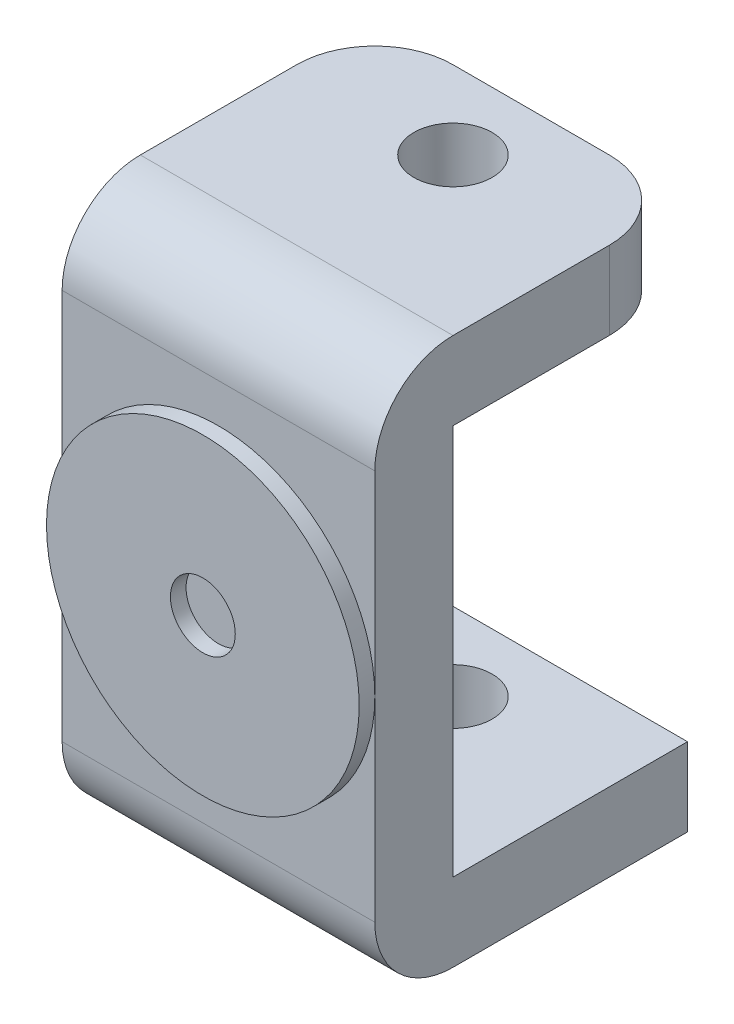
from build123d import *

# Parameters (mm, degrees)
SKETCH1_W           = 4
SKETCH1_H           = 5
BOSS_EXTRUDE1_DEPTH = 1
SKETCH2_W           = 4
SKETCH2_H           = 1
BOSS_EXTRUDE2_DEPTH = 2
FILLET1_R           = 1
SKETCH3_R           = 2
SKETCH3_R_2         = 0.415
BOSS_EXTRUDE3_DEPTH = 0.2
SKETCH4_R           = 0.5
CUT_EXTRUDE1_DEPTH  = 8.874007874


with BuildPart() as part:
    # Sketch1 → Boss-Extrude1 (new body)
    with BuildSketch(Plane.XY):
        Rectangle(SKETCH1_W, SKETCH1_H)
    extrude(amount=BOSS_EXTRUDE1_DEPTH)

    # Sketch2 → Boss-Extrude2 (add, symmetric)
    with BuildSketch(Plane(origin=(0, 0, 0), x_dir=(0, 0, -1), z_dir=(1, 0, 0))):
        with Locations((1, 3)):
            Rectangle(SKETCH2_W, SKETCH2_H)
        with Locations((1, -3)):
            Rectangle(SKETCH2_W, SKETCH2_H)
    extrude(amount=BOSS_EXTRUDE2_DEPTH, both=True)

    # Fillet1
    fillet1_edges = [part.edges().sort_by_distance(p)[0] for p in [
        (0, 3.5, 1),
        (-2, 3, -3),
        (2, 3, -3),
        (0, -3.5, 1),
    ]]
    fillet(fillet1_edges, radius=FILLET1_R)

    # Sketch3 → Boss-Extrude3 (add)
    with BuildSketch(Plane.XY.offset(1)):
        Circle(SKETCH3_R)
        Circle(SKETCH3_R_2, mode=Mode.SUBTRACT)
    extrude(amount=BOSS_EXTRUDE3_DEPTH)

    # Sketch4 → Cut-Extrude1 (cut, through all)
    with BuildSketch(Plane.XZ.offset(3.5)):
        with Locations(Location((0, -2, 0), (0, 0, 270))):
            Circle(SKETCH4_R)
    extrude(amount=-CUT_EXTRUDE1_DEPTH, mode=Mode.SUBTRACT)


solid = part.part
